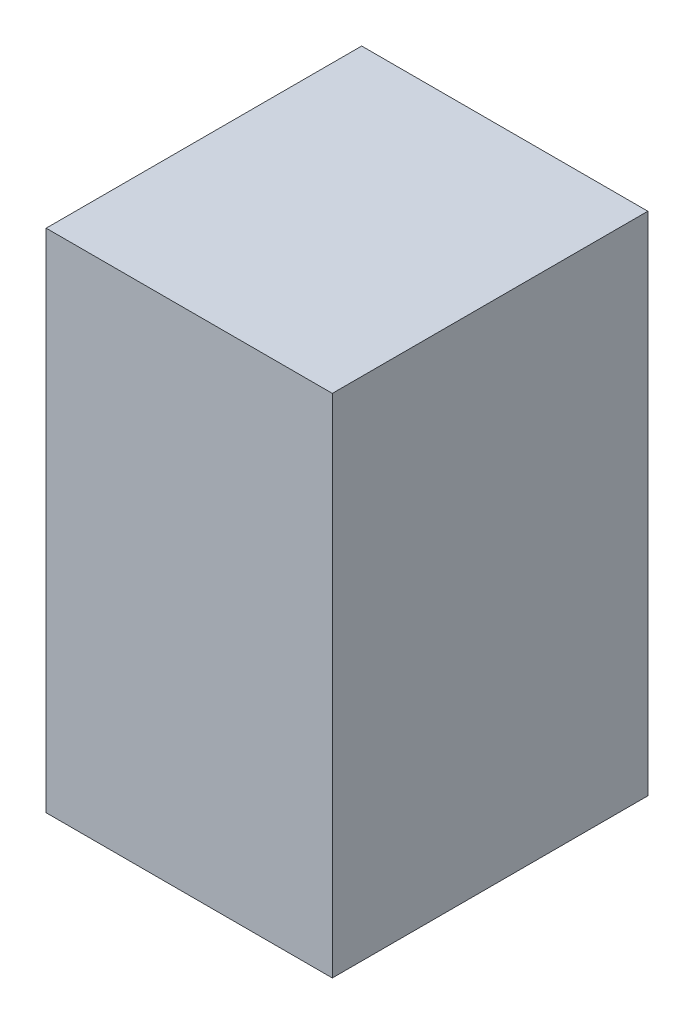
from build123d import *

# Parameters (mm, degrees)
SKETCH_1_W      = 39
SKETCH_1_H      = 69
EXTRUDE_1_DEPTH = 43


with BuildPart() as part:
    # ｽｹｯﾁ1 → ﾎﾞｽ - 押し出し1 (new body)
    with BuildSketch(Plane.XY):
        with Locations((-3.151560295, -4.75)):
            Rectangle(SKETCH_1_W, SKETCH_1_H)
    extrude(amount=EXTRUDE_1_DEPTH)


solid = part.part
